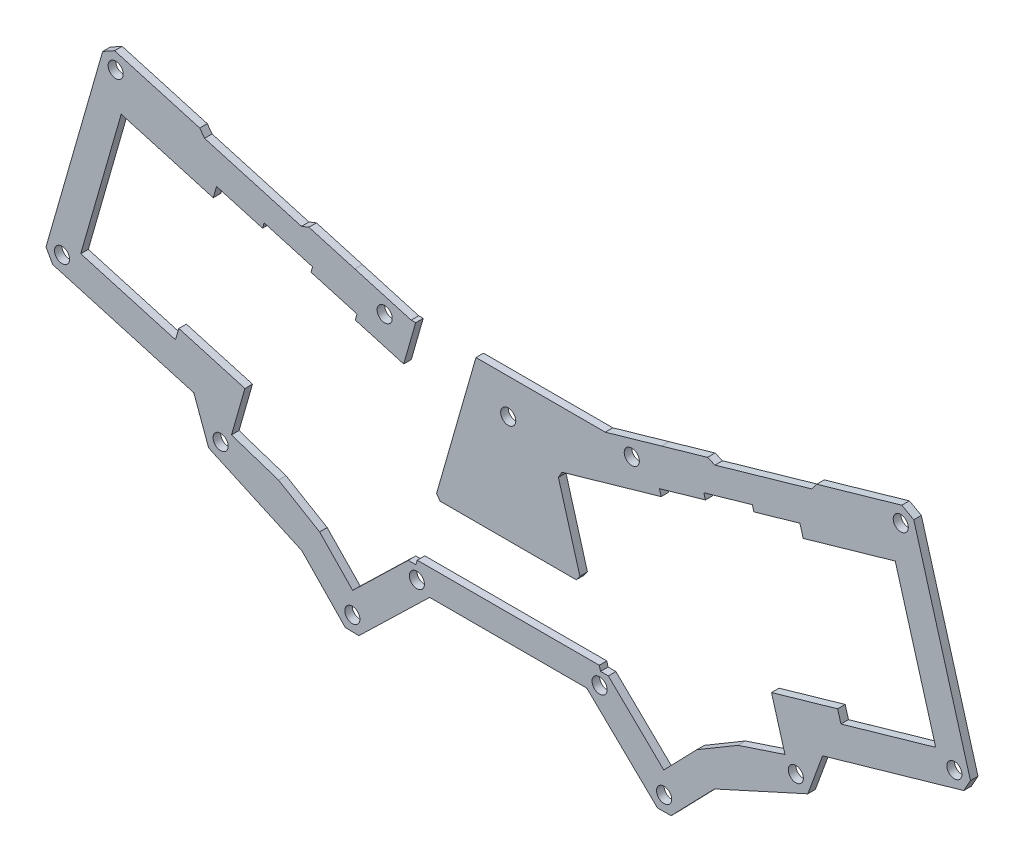
from build123d import *

# Parameters (mm, degrees)
ESQUISSE1_R        = 3
BOSS_EXTRU_1_DEPTH = 3


with BuildPart() as part:
    # Esquisse1 → Boss.-Extru.1 (new body)
    with BuildSketch(Plane.XY):
        Polygon((-106.057456456, -118.225792128), (-128.0696158, -96.878899722), (-131.150893181, -96.85509979), (-131.678504691, -95.01509979), (-203.912015052, -95.01509979), (-204.439626562, -96.85509979), (-207.491865187, -96.85509979), (-208.236606037, -97.572971364), (-229.533063287, -118.225792128), (-242.655085998, -104.673746846), (-258.969310369, -95.012679745), (-277.629290011, -88.825419148), (-272.289144354, -70.202118055), (-298.538981418, -62.6750984), (-299.849714513, -67.246167925), (-337.461409717, -56.461187875), (-321.404434006, -0.463858857), (-284.873898651, -10.938821309), (-283.564528344, -6.372504389), (-265.299260667, -11.609985616), (-264.679553884, -9.448811229), (-245.452786066, -14.960840928), (-246.072799476, -17.123084647), (-227.807531798, -22.360565873), (-228.496674065, -24.763890567), (-209.275142378, -30.275576085), (-204.522611526, -13.701531345), (-206.306232172, -13.701531345), (-228.687205955, -7.283890384), (-246.894010665, -2.064269008), (-249.872259625, -3.248768002), (-288.323340616, 7.774587685), (-290.221637422, 10.357120157), (-324.023652204, 20.047657387), (-328.759186056, 17.422535954), (-351.248940808, -61.008559605), (-348.624077987, -65.743937486), (-292.570685007, -81.816989279), (-286.703799003, -97.823971184), (-249.693611115, -114.655437515), (-232.462472657, -132.451258614), (-227.051679806, -132.536382762), (-198.975350278, -105.350948678), (-136.615169465, -105.350948678), (-108.538839937, -132.536382762), (-103.128047086, -132.451258614), (-85.896908628, -114.655437515), (-48.88672074, -97.823971184), (-43.019834736, -81.816989279), (13.033558244, -65.743937486), (15.658421065, -61.008559605), (-6.831333687, 17.422535954), (-11.566867539, 20.047657387), (-45.368882322, 10.357120157), (-47.267179127, 7.774587685), (-85.718260118, -3.248768002), (-88.696509078, -2.064269008), (-106.903313789, -7.283890384), (-129.284287571, -13.701531345), (-180.595724501, -13.701531345), (-196.24658732, -68.282576398), (-194.797862031, -70.20509979), (-140.792657712, -70.20509979), (-139.343932423, -68.282576398), (-147.87312166, -38.537758661), (-146.501872979, -36.063960558), (-107.093845678, -24.763890567), (-107.782987945, -22.360565873), (-89.517720268, -17.123084647), (-90.137733677, -14.960840928), (-70.910965859, -9.448811229), (-70.291259076, -11.609985616), (-52.025991399, -6.372504389), (-50.716621092, -10.938821309), (-14.186085737, -0.463858857), (1.870889973, -56.461187875), (-35.740805231, -67.246167925), (-37.051538325, -62.6750984), (-63.301375389, -70.202118055), (-57.961229733, -88.825419148), (-76.621209374, -95.012679745), (-92.935433745, -104.673746846), align=None)
        with Locations((-281.934339477, -93.401689518)):
            Circle(ESQUISSE1_R, mode=Mode.SUBTRACT)
        with Locations((-229.666591606, -126.713325795)):
            Circle(ESQUISSE1_R, mode=Mode.SUBTRACT)
        with Locations((-204.059552706, -101.880200807)):
            Circle(ESQUISSE1_R, mode=Mode.SUBTRACT)
        with Locations((-344.882804027, -60.574933915)):
            Circle(ESQUISSE1_R, mode=Mode.SUBTRACT)
        with Locations((-105.923928137, -126.713325795)):
            Circle(ESQUISSE1_R, mode=Mode.SUBTRACT)
        with Locations((-131.530967037, -101.880200807)):
            Circle(ESQUISSE1_R, mode=Mode.SUBTRACT)
        with Locations((-53.656180266, -93.401689518)):
            Circle(ESQUISSE1_R, mode=Mode.SUBTRACT)
        with Locations((9.292284284, -60.574933915)):
            Circle(ESQUISSE1_R, mode=Mode.SUBTRACT)
        with Locations((-323.590068827, 13.68165837)):
            Circle(ESQUISSE1_R, mode=Mode.SUBTRACT)
        with Locations((-216.832585966, -16.924131519)):
            Circle(ESQUISSE1_R, mode=Mode.SUBTRACT)
        with Locations((-118.757933777, -16.924131519)):
            Circle(ESQUISSE1_R, mode=Mode.SUBTRACT)
        with Locations((-12.000450916, 13.68165837)):
            Circle(ESQUISSE1_R, mode=Mode.SUBTRACT)
        with Locations((-167.795259872, -27.605548894)):
            Circle(ESQUISSE1_R, mode=Mode.SUBTRACT)
    extrude(amount=BOSS_EXTRU_1_DEPTH)


solid = part.part
